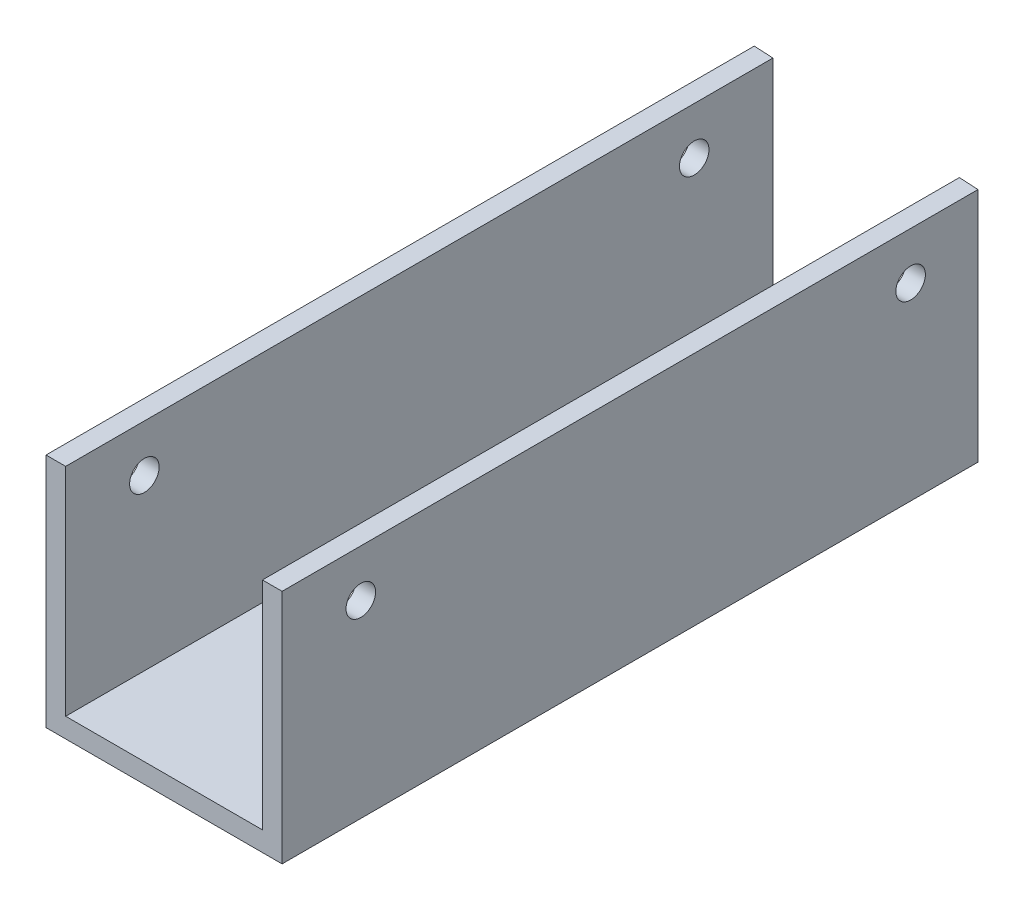
from build123d import *

# Parameters (mm, degrees)
BOSS_EXTRUDE1_DEPTH = 114.3
CUT_EXTRUDE1_DEPTH  = 98.425
SKETCH3_R           = 2.38125
CUT_EXTRUDE2_DEPTH  = 98.425
SKETCH4_W           = 31.75
SKETCH4_H           = 7.9375
CUT_EXTRUDE4_DEPTH  = 122.134097336


with BuildPart() as part:
    # Sketch1 → Boss-Extrude1 (new body)
    with BuildSketch(Plane.XY):
        Polygon((18.371241491, 0), (-19.728758509, 0), (-19.728758509, 38.1), (-16.553758509, 38.1), (-16.553758509, 3.175), (15.196241491, 3.175), (15.196241491, 38.1), (18.371241491, 38.1), align=None)
    extrude(amount=BOSS_EXTRUDE1_DEPTH)

    # Sketch2 → Cut-Extrude1 (cut)
    with BuildSketch(Plane(origin=(0, 38.1, 0), x_dir=(1, 0, 0), z_dir=(0, 1, 0))):
        Polygon((-19.728758509, 0), (18.371241491, 0), (18.371241491, -1.996736391), align=None)
    extrude(amount=-CUT_EXTRUDE1_DEPTH, mode=Mode.SUBTRACT)

    # Sketch3 → Cut-Extrude2 (cut)
    with BuildSketch(Plane(origin=(18.371241491, 0, 0), x_dir=(0, 0, -1), z_dir=(1, 0, 0))):
        with Locations((-12.866394699, 30.48)):
            Circle(SKETCH3_R)
        with Locations((-101.6, 30.48)):
            Circle(SKETCH3_R)
    extrude(amount=-CUT_EXTRUDE2_DEPTH, mode=Mode.SUBTRACT)

    # Sketch4 → Cut-Extrude4 (cut, through all)
    with BuildSketch(Plane(origin=(0, 3.175, 0), x_dir=(1, 0, 0), z_dir=(0, 1, 0))):
        with Locations((-0.678758509, -72.23125)):
            Rectangle(SKETCH4_W, SKETCH4_H)
    extrude(amount=-CUT_EXTRUDE4_DEPTH, mode=Mode.SUBTRACT)


solid = part.part
